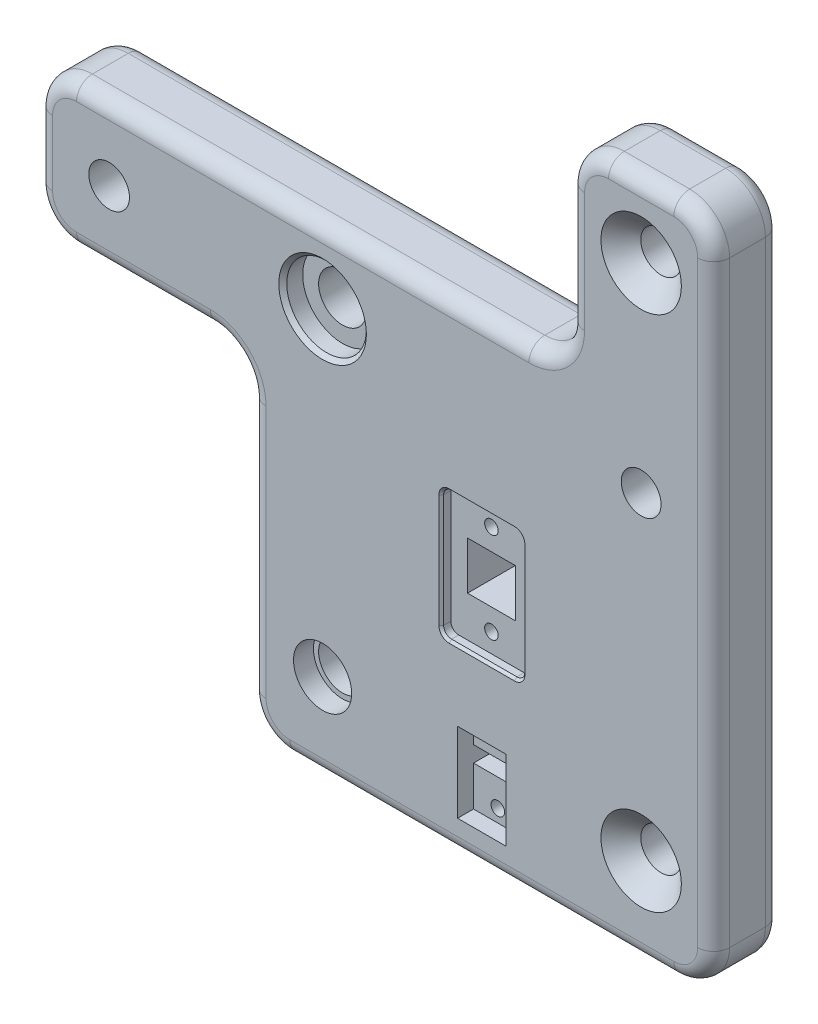
from build123d import *

# Parameters (mm, degrees)
SKETCH_2_R           = 3
SKETCH_2_R_2         = 2.5
SKETCH_2_R_3         = 2.55
SKETCH_2_W           = 6
SKETCH_2_H           = 6
SKETCH_2_W_2         = 6.1
SKETCH_2_H_2         = 2
EXTRUDE_2_DEPTH      = 8.5
CHAMFER_3_SIZE       = 2.5
FILLET_1_R           = 3
CUT_EXTRUDE_1_DEPTH  = 1.2
SKETCH_4_R           = 0.85
CUT_EXTRUDE_2_DEPTH  = 5
CUT_EXTRUDE_3_DEPTH  = 1.2
SKETCH_6_R           = 0.85
CUT_EXTRUDE_4_DEPTH  = 5
FILLET_2_R           = 2
SKETCH_7_W           = 6.1
SKETCH_7_H           = 10
CUT_EXTRUDE_5_DEPTH  = 2
SKETCH_8_R           = 0.85
CUT_EXTRUDE_6_DEPTH  = 5
SKETCH_9_R           = 3.65
CUT_EXTRUDE_7_DEPTH  = 2.5
SKETCH_10_R          = 3.65
CUT_EXTRUDE_8_DEPTH  = 2.5
SKETCH_11_R          = 5
CUT_EXTRUDE_9_DEPTH  = 2.5
SKETCH_12_R          = 5
CUT_EXTRUDE_10_DEPTH = 2.5
CHAMFER_4_SIZE       = 0.5
CHAMFER_5_SIZE       = 0.3


with BuildPart() as part:
    # 草图2 → 凸台-拉伸2 (new body)
    with BuildSketch(Plane.XY):
        with BuildLine():
            Line((-10.9, 9.1), (25.9, 9.1))
            ThreePointArc((25.9, 9.1), (29.435533906, 10.564466094), (30.9, 14.1))
            Line((30.9, 14.1), (30.9, 29.1))
            ThreePointArc((30.9, 29.1), (32.364466094, 32.635533906), (35.9, 34.1))
            Line((35.9, 34.1), (44.1, 34.1))
            ThreePointArc((44.1, 34.1), (47.635533906, 32.635533906), (49.1, 29.1))
            Line((49.1, 29.1), (49.1, 9.1))
            Line((49.1, 9.1), (49.1, -45.9))
            ThreePointArc((49.1, -45.9), (47.635533906, -49.435533906), (44.1, -50.9))
            Line((44.1, -50.9), (-4.1, -50.9))
            ThreePointArc((-4.1, -50.9), (-7.635533906, -49.435533906), (-9.1, -45.9))
            Line((-9.1, -45.9), (-9.1, -14.1))
            ThreePointArc((-9.1, -14.1), (-10.564466094, -10.564466094), (-14.1, -9.1))
            Line((-14.1, -9.1), (-30.9, -9.1))
            ThreePointArc((-30.9, -9.1), (-34.435533906, -7.635533906), (-35.9, -4.1))
            Line((-35.9, -4.1), (-35.9, 4.1))
            ThreePointArc((-35.9, 4.1), (-34.435533906, 7.635533906), (-30.9, 9.1))
            Line((-30.9, 9.1), (-10.9, 9.1))
        make_face()
        Circle(SKETCH_2_R, mode=Mode.SUBTRACT)
        with Locations((40, 0)):
            Circle(SKETCH_2_R_2, mode=Mode.SUBTRACT)
        with Locations((0, -40)):
            Circle(SKETCH_2_R, mode=Mode.SUBTRACT)
        with Locations((40, -40)):
            Circle(SKETCH_2_R_3, mode=Mode.SUBTRACT)
        with Locations((40, 25)):
            Circle(SKETCH_2_R_3, mode=Mode.SUBTRACT)
        with Locations((-26.8, 0)):
            Circle(SKETCH_2_R_3, mode=Mode.SUBTRACT)
        with Locations((20, -20)):
            Rectangle(SKETCH_2_W, SKETCH_2_H, mode=Mode.SUBTRACT)
        with Locations((20, -40.9)):
            Rectangle(SKETCH_2_W_2, SKETCH_2_H_2, mode=Mode.SUBTRACT)
    extrude(amount=EXTRUDE_2_DEPTH)

    # 倒角3
    chamfer_3_edges = [part.edges().sort_by_distance(p)[0] for p in [
        (37.5, 0, 0),
        (37.45, -40, 8.5),
        (37.45, 25, 8.5),
        (-29.35, 0, 0),
    ]]
    chamfer(chamfer_3_edges, length=CHAMFER_3_SIZE)

    # 圆角1
    fillet_1_edges = [part.edges().sort_by_distance(p)[0] for p in [
        (20, -41.9, 0),
    ]]
    fillet(fillet_1_edges, radius=FILLET_1_R)

    # 草图3 → 切除-拉伸1 (cut)
    with BuildSketch(Plane.XY.offset(8.5)):
        with BuildLine():
            Line((15.9, -11.9), (24.1, -11.9))
            ThreePointArc((24.1, -11.9), (24.807106781, -12.192893219), (25.1, -12.9))
            Line((25.1, -12.9), (25.1, -27.1))
            ThreePointArc((25.1, -27.1), (24.807106781, -27.807106781), (24.1, -28.1))
            Line((24.1, -28.1), (15.9, -28.1))
            ThreePointArc((15.9, -28.1), (15.192893219, -27.807106781), (14.9, -27.1))
            Line((14.9, -27.1), (14.9, -12.9))
            ThreePointArc((14.9, -12.9), (15.192893219, -12.192893219), (15.9, -11.9))
        make_face()
    extrude(amount=-CUT_EXTRUDE_1_DEPTH, mode=Mode.SUBTRACT)

    # 草图4 → 切除-拉伸2 (cut)
    with BuildSketch(Plane.XY.offset(7.3)):
        with Locations((20, -14.3)):
            Circle(SKETCH_4_R)
        with Locations(Location((20, -25.7, 0), (0, 0, 180))):
            Circle(SKETCH_4_R)
    extrude(amount=-CUT_EXTRUDE_2_DEPTH, mode=Mode.SUBTRACT)

    # 草图5 → 切除-拉伸3 (cut)
    with BuildSketch(Plane(origin=(0, 0, 0), x_dir=(-1, 0, 0), z_dir=(0, 0, -1))):
        with BuildLine():
            Line((-27.1, -14.9), (-12.9, -14.9))
            ThreePointArc((-12.9, -14.9), (-12.192893219, -15.192893219), (-11.9, -15.9))
            Line((-11.9, -15.9), (-11.9, -24.1))
            ThreePointArc((-11.9, -24.1), (-12.192893219, -24.807106781), (-12.9, -25.1))
            Line((-12.9, -25.1), (-27.1, -25.1))
            ThreePointArc((-27.1, -25.1), (-27.807106781, -24.807106781), (-28.1, -24.1))
            Line((-28.1, -24.1), (-28.1, -15.9))
            ThreePointArc((-28.1, -15.9), (-27.807106781, -15.192893219), (-27.1, -14.9))
        make_face()
    extrude(amount=-CUT_EXTRUDE_3_DEPTH, mode=Mode.SUBTRACT)

    # 草图6 → 切除-拉伸4 (cut)
    with BuildSketch(Plane(origin=(0, 0, 1.2), x_dir=(-1, 0, 0), z_dir=(0, 0, -1))):
        with Locations((-25.7, -20)):
            Circle(SKETCH_6_R)
        with Locations(Location((-14.3, -20, 0), (0, 0, 180))):
            Circle(SKETCH_6_R)
    extrude(amount=-CUT_EXTRUDE_4_DEPTH, mode=Mode.SUBTRACT)

    # 圆角2
    fillet_2_edges = [part.edges().sort_by_distance(p)[0] for p in [
        (-35.9, 0, 8.5),
        (-34.435533906, -7.635533906, 8.5),
        (-2.5, 9.1, 0),
        (-22.5, -9.1, 8.5),
        (29.435533906, 10.564466094, 0),
        (30.9, 21.6, 0),
        (32.364466094, 32.635533906, 0),
        (40, 34.1, 0),
        (47.635533906, 32.635533906, 0),
        (49.1, -8.4, 0),
        (47.635533906, -49.435533906, 0),
        (-10.564466094, -10.564466094, 8.5),
        (20, -50.9, 0),
        (-7.635533906, -49.435533906, 0),
        (-9.1, -30, 0),
        (-10.564466094, -10.564466094, 0),
        (-22.5, -9.1, 0),
        (-34.435533906, -7.635533906, 0),
        (-35.9, 0, 0),
        (-9.1, -30, 8.5),
        (-34.435533906, 7.635533906, 0),
        (-7.635533906, -49.435533906, 8.5),
        (20, -50.9, 8.5),
        (47.635533906, -49.435533906, 8.5),
        (49.1, -8.4, 8.5),
        (-2.5, 9.1, 8.5),
        (47.635533906, 32.635533906, 8.5),
        (40, 34.1, 8.5),
        (32.364466094, 32.635533906, 8.5),
        (30.9, 21.6, 8.5),
        (29.435533906, 10.564466094, 8.5),
        (-34.435533906, 7.635533906, 8.5),
    ]]
    fillet(fillet_2_edges, radius=FILLET_2_R)

    # 草图7 → 切除-拉伸5 (cut)
    with BuildSketch(Plane(origin=(0, 0, 8.5), x_dir=(-1, 0, 0), z_dir=(0, 0, -1))):
        with Locations((-20, -41.9)):
            Rectangle(SKETCH_7_W, SKETCH_7_H)
    extrude(amount=CUT_EXTRUDE_5_DEPTH, mode=Mode.SUBTRACT)

    # 草图8 → 切除-拉伸6 (cut)
    with BuildSketch(Plane.XY.offset(6.5)):
        with Locations((20, -45.3)):
            Circle(SKETCH_8_R)
    extrude(amount=-CUT_EXTRUDE_6_DEPTH, mode=Mode.SUBTRACT)

    # 草图9 → 切除-拉伸7 (cut)
    with BuildSketch(Plane.XY.offset(8.5)):
        with Locations((0, -40)):
            Circle(SKETCH_9_R)
    extrude(amount=-CUT_EXTRUDE_7_DEPTH, mode=Mode.SUBTRACT)

    # 草图10 → 切除-拉伸8 (cut)
    with BuildSketch(Plane(origin=(0, 0, 0), x_dir=(-1, 0, 0), z_dir=(0, 0, -1))):
        Circle(SKETCH_10_R)
    extrude(amount=-CUT_EXTRUDE_8_DEPTH, mode=Mode.SUBTRACT)

    # 草图11 → 切除-拉伸9 (cut)
    with BuildSketch(Plane(origin=(0, 0, 0), x_dir=(-1, 0, 0), z_dir=(0, 0, -1))):
        with Locations((0, -40)):
            Circle(SKETCH_11_R)
    extrude(amount=-CUT_EXTRUDE_9_DEPTH, mode=Mode.SUBTRACT)

    # 草图12 → 切除-拉伸10 (cut)
    with BuildSketch(Plane.XY.offset(8.5)):
        Circle(SKETCH_12_R)
    extrude(amount=-CUT_EXTRUDE_10_DEPTH, mode=Mode.SUBTRACT)

    # 倒角4
    chamfer_4_edges = [part.edges().sort_by_distance(p)[0] for p in [
        (5, -40, 0),
        (-5, 0, 8.5),
    ]]
    chamfer(chamfer_4_edges, length=CHAMFER_4_SIZE)

    # 倒角5
    chamfer_5_edges = [part.edges().sort_by_distance(p)[0] for p in [
        (24.807106781, -27.807106781, 8.5),
        (25.1, -20, 8.5),
        (24.807106781, -12.192893219, 8.5),
        (20, -11.9, 8.5),
        (15.192893219, -12.192893219, 8.5),
        (14.9, -20, 8.5),
        (15.192893219, -27.807106781, 8.5),
        (20, -28.1, 8.5),
        (12.192893219, -15.192893219, 0),
        (20, -14.9, 0),
        (27.807106781, -15.192893219, 0),
        (28.1, -20, 0),
        (27.807106781, -24.807106781, 0),
        (20, -25.1, 0),
        (12.192893219, -24.807106781, 0),
        (11.9, -20, 0),
    ]]
    chamfer(chamfer_5_edges, length=CHAMFER_5_SIZE)


solid = part.part
